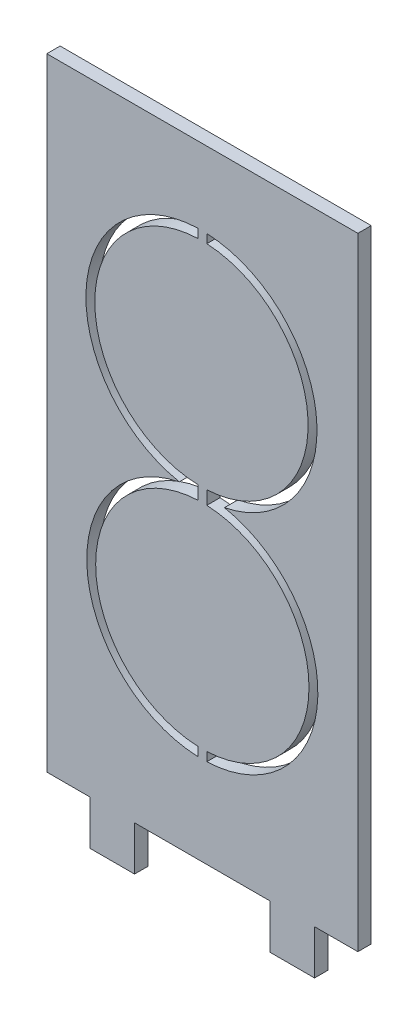
from build123d import *

# Parameters (mm, degrees)
SKIZZE1_W                        = 35
SKIZZE1_H                        = 75
AUFSATZ_LINEAR_AUSTRAGEN1_DEPTH  = 1.5
SKIZZE3_W                        = 15.25
SKIZZE3_H                        = 5
SKIZZE3_W_2                      = 4.875
SCHNITT_LINEAR_AUSTRAGEN12_DEPTH = 20
SKIZZE13_R                       = 12
SCHNITT_LINEAR_AUSTRAGEN18_DEPTH = 1.5
SKIZZE14_W                       = 1
SKIZZE14_H                       = 57.312152727
AUFSATZ_LINEAR_AUSTRAGEN8_DEPTH  = 1.5


with BuildPart() as part:
    # Skizze1 → Aufsatz-Linear austragen1 (new body)
    with BuildSketch(Plane.XY):
        with Locations((17.5, 37.5)):
            Rectangle(SKIZZE1_W, SKIZZE1_H)
    extrude(amount=AUFSATZ_LINEAR_AUSTRAGEN1_DEPTH)

    # Skizze3 → Schnitt-Linear austragen12 (cut)
    with BuildSketch(Plane.XY.offset(1.5)):
        with Locations((17.5, 2.5)):
            Rectangle(SKIZZE3_W, SKIZZE3_H)
        with Locations((32.5625, 2.5)):
            Rectangle(SKIZZE3_W_2, SKIZZE3_H)
        with Locations((2.4375, 2.5)):
            Rectangle(SKIZZE3_W_2, SKIZZE3_H)
    extrude(amount=-SCHNITT_LINEAR_AUSTRAGEN12_DEPTH, mode=Mode.SUBTRACT)

    # Skizze13 → Schnitt-Linear austragen18 (cut)
    with BuildSketch(Plane.XY.offset(1.5)):
        with BuildLine():
            Line((14.905768525, 40.7415201), (14.913283553, 40.740050943))
            ThreePointArc((14.913283553, 40.740050943), (17.550982946, 15.000099972), (19.986710673, 40.759947885))
            ThreePointArc((19.986710673, 40.759947885), (17.352851338, 66.4999145), (14.905768525, 40.7415201))
        make_face()
        with Locations((17.4, 53.5)):
            Circle(SKIZZE13_R, mode=Mode.SUBTRACT)
        with Locations((17.5, 28)):
            Circle(SKIZZE13_R, mode=Mode.SUBTRACT)
    extrude(amount=-SCHNITT_LINEAR_AUSTRAGEN18_DEPTH, mode=Mode.SUBTRACT)


with BuildPart() as schnitt_linear_austragen18_piece_1:
    # of the separate pieces the step leaves, piece 1, a body of its own (schnitt_linear_austragen18_pieces)
    add(part.part.solids().sort_by_distance((4.875, 0, 0))[0])



with BuildPart() as schnitt_linear_austragen18_piece_2:
    # of the separate pieces the step leaves, piece 2, a body of its own (schnitt_linear_austragen18_pieces)
    add(part.part.solids().sort_by_distance((29.4, 53.5, 0))[0])


with BuildPart() as schnitt_linear_austragen18_piece_3:
    # of the separate pieces the step leaves, piece 3, a body of its own (schnitt_linear_austragen18_pieces)
    add(part.part.solids().sort_by_distance((29.5, 28, 0))[0])


with BuildPart() as schnitt_linear_austragen18_piece_1_1:
    add(schnitt_linear_austragen18_piece_1.part)

    add(schnitt_linear_austragen18_piece_2.part)  # Aufsatz-Linear austragen8 merges Schnitt-Linear austragen18 piece 2

    add(schnitt_linear_austragen18_piece_3.part)  # Aufsatz-Linear austragen8 merges Schnitt-Linear austragen18 piece 3
    # Skizze14 → Aufsatz-Linear austragen8 (add)
    with BuildSketch(Plane.XY.offset(1.5)):
        with Locations((17.5, 39.529651928)):
            Rectangle(SKIZZE14_W, SKIZZE14_H)
    extrude(amount=-AUFSATZ_LINEAR_AUSTRAGEN8_DEPTH)


solid = schnitt_linear_austragen18_piece_1_1.part
